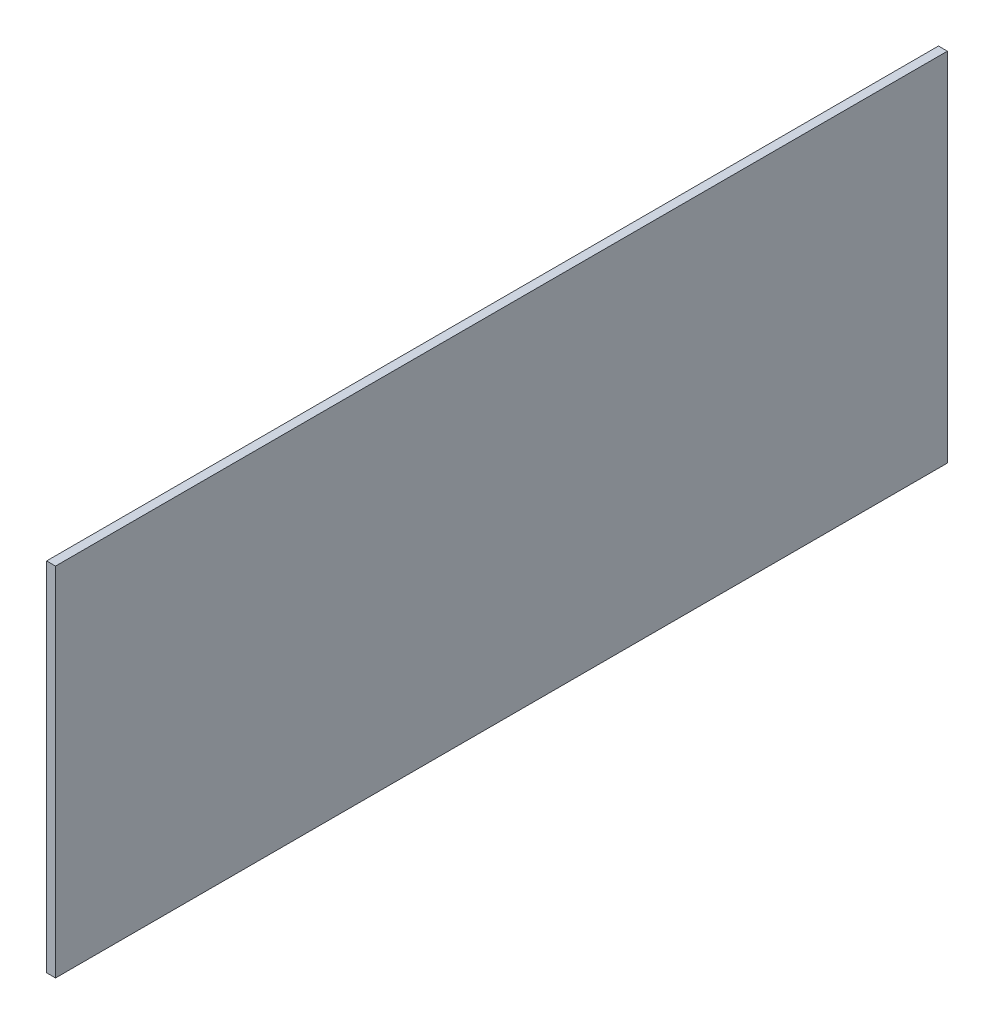
from build123d import *

# Parameters (mm, degrees)
SKETCH1_W           = 1000
SKETCH1_H           = 400
BOSS_EXTRUDE1_DEPTH = 10


with BuildPart() as part:
    # Sketch1 → Boss-Extrude1 (new body)
    with BuildSketch(Plane(origin=(0, 0, 0), x_dir=(0, 0, -1), z_dir=(1, 0, 0))):
        Rectangle(SKETCH1_W, SKETCH1_H)
    extrude(amount=BOSS_EXTRUDE1_DEPTH)


solid = part.part
